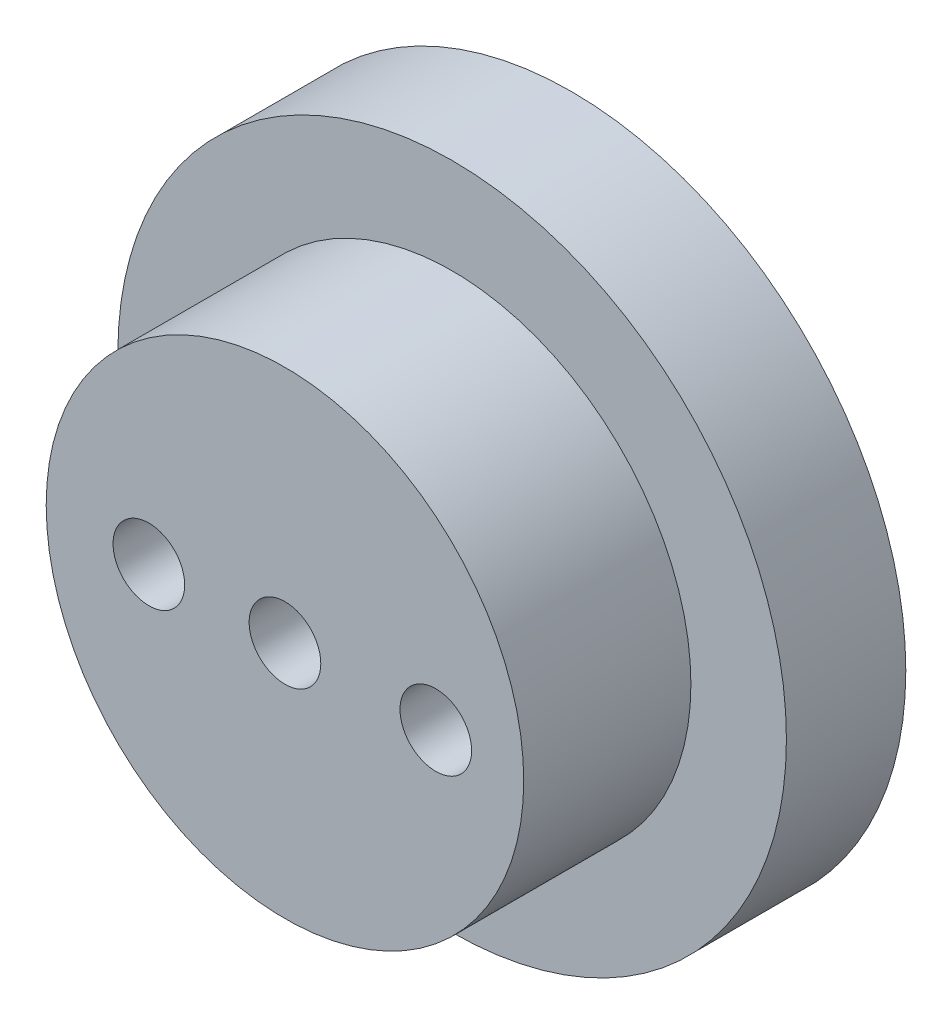
from build123d import *

# Parameters (mm, degrees)
SKETCH1_R           = 14
BOSS_EXTRUDE1_DEPTH = 5
SKETCH2_R           = 10
BOSS_EXTRUDE2_DEPTH = 7
SKETCH3_R           = 1.5
CUT_EXTRUDE1_DEPTH  = 24.151673806
CUT_EXTRUDE2_REACH  = 25.152
SKETCH4_R           = 1.5


with BuildPart() as part:
    # Sketch1 → Boss-Extrude1 (new body)
    with BuildSketch(Plane.XY):
        Circle(SKETCH1_R)
    extrude(amount=BOSS_EXTRUDE1_DEPTH)

    # Sketch2 → Boss-Extrude2 (add)
    with BuildSketch(Plane.XY.offset(5)):
        Circle(SKETCH2_R)
    extrude(amount=BOSS_EXTRUDE2_DEPTH)

    # Sketch3 → Cut-Extrude1 (cut, through all)
    with BuildSketch(Plane.XY.offset(12)):
        Circle(SKETCH3_R)
    extrude(amount=-CUT_EXTRUDE1_DEPTH, mode=Mode.SUBTRACT)

    # Sketch4 → Cut-Extrude2 (cut, up to next)
    with BuildSketch(Plane.XY.offset(12), mode=Mode.PRIVATE) as cut_extrude2_sk1:
        with Locations((-5.699704026, 0)):
            Circle(SKETCH4_R)
    cut_extrude2_tool1 = extrude(cut_extrude2_sk1.sketch, amount=-CUT_EXTRUDE2_REACH, mode=Mode.PRIVATE) & part.part
    # Sketch4 → Cut-Extrude2 (cut, up to next)
    with BuildSketch(Plane.XY.offset(12), mode=Mode.PRIVATE) as cut_extrude2_sk2:
        with Locations((6.316954824, 0)):
            Circle(SKETCH4_R)
    cut_extrude2_tool2 = extrude(cut_extrude2_sk2.sketch, amount=-CUT_EXTRUDE2_REACH, mode=Mode.PRIVATE) & part.part
    add(cut_extrude2_tool1.solids().sort_by_distance((-5.699704, 0, 12))[0], mode=Mode.SUBTRACT)
    add(cut_extrude2_tool2.solids().sort_by_distance((6.316955, 0, 12))[0], mode=Mode.SUBTRACT)


solid = part.part
